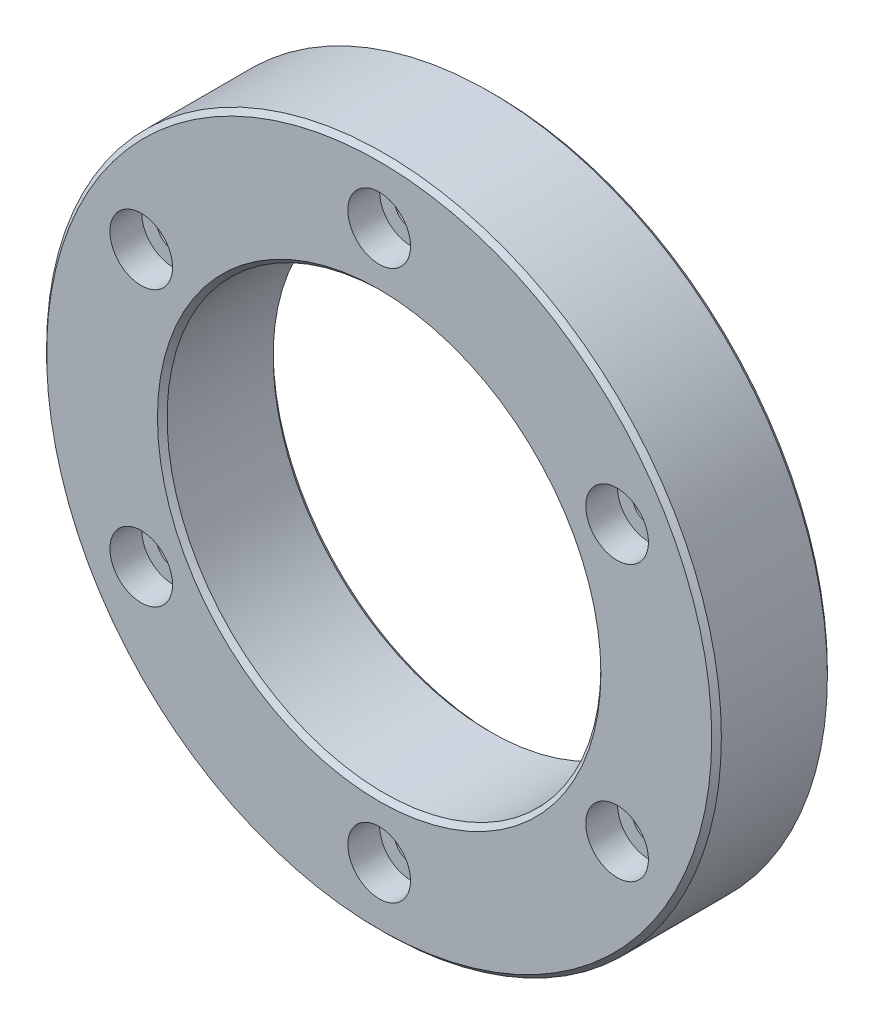
from build123d import *

# Parameters (mm, degrees)
SKETCH_1_R                   = 35
SKETCH_1_R_2                 = 22.5
EXTRUDE_1_DEPTH              = 6
HOLE_WIZARD_M3_1_D           = 3.4
HOLE_WIZARD_M3_1_CBORE_D     = 6.5
HOLE_WIZARD_M3_1_CBORE_DEPTH = 3.3
PATTERN_CIRCULAR_1_COUNT     = 6
CHAMFER_1_SIZE               = 0.5


with BuildPart() as part:
    # 스케치1 → 보스-돌출1 (new, symmetric)
    with BuildSketch(Plane.XY):
        Circle(SKETCH_1_R)
        Circle(SKETCH_1_R_2, mode=Mode.SUBTRACT)
    extrude(amount=EXTRUDE_1_DEPTH, both=True)

    # M3 육각 소켓 머리 캡 나사용 카운터보어1 (through all)
    with Locations(Plane.XY.offset(6)):
        with Locations((0, 28.5)):
            hole_wizard_m3_1 = CounterBoreHole(HOLE_WIZARD_M3_1_D / 2, HOLE_WIZARD_M3_1_CBORE_D / 2, HOLE_WIZARD_M3_1_CBORE_DEPTH)

    # 원형 패턴1: M3 육각 소켓 머리 캡 나사용 카운터보어1 ×6 about axis
    pattern_circular_1_axis = Axis((0, 0, 6), (0, 0, -1))
    for i in range(1, PATTERN_CIRCULAR_1_COUNT):
        add(hole_wizard_m3_1.rotate(pattern_circular_1_axis, i * 360 / PATTERN_CIRCULAR_1_COUNT), mode=Mode.SUBTRACT)

    # 모따기1
    chamfer_1_edges = [part.edges().sort_by_distance(p)[0] for p in [
        (-35, 0, -6),
        (-35, 0, 6),
        (-22.5, 0, -6),
        (-22.5, 0, 6),
    ]]
    chamfer(chamfer_1_edges, length=CHAMFER_1_SIZE)


solid = part.part
